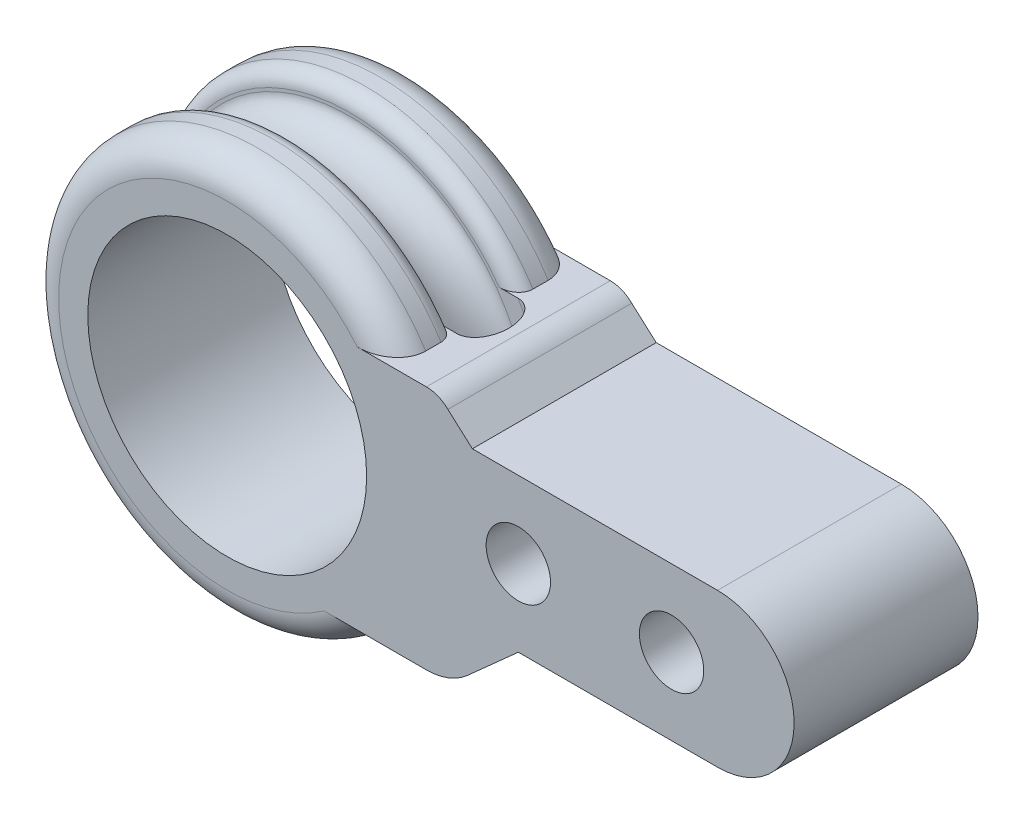
from build123d import *

# Parameters (mm, degrees)
BOSS_EXTRUDE1_DEPTH = 6
SKETCH1_5_R         = 4.55
CUT_EXTRUDE2_DEPTH  = 21.506096654
SKETCH1_6_R         = 1.05
CUT_EXTRUDE3_DEPTH  = 21.506096654
FILLET1_R           = 1
FILLET3_R           = 0.5


with BuildPart() as part:
    # Sketch1 → Boss-Extrude1 (new body)
    with BuildSketch(Plane.XY):
        with BuildLine():
            Line((9.5, -2.5), (16, -2.5))
            ThreePointArc((16, -2.5), (18.5, 0), (16, 2.5))
            Line((16, 2.5), (8, 2.5))
            Line((8, 2.5), (7.201136344, 3.213027227))
            ThreePointArc((7.201136344, 3.213027227), (6.878795969, 3.425480207), (6.5, 3.5))
            Line((6.5, 3.5), (5.477225575, 3.5))
            ThreePointArc((5.477225575, 3.5), (-6.468789112, 0.636213346), (4.69041576, -4.5))
            Line((4.69041576, -4.5), (6.5, -4.5))
            ThreePointArc((6.5, -4.5), (7.21364418, -4.368344718), (7.833333333, -3.990711985))
            Line((7.833333333, -3.990711985), (9.5, -2.5))
        make_face()
    extrude(amount=BOSS_EXTRUDE1_DEPTH)

    # Sketch1<5> → Cut-Extrude2 (cut, through all)
    with BuildSketch(Plane.XY):
        Circle(SKETCH1_5_R)
    extrude(amount=CUT_EXTRUDE2_DEPTH, mode=Mode.SUBTRACT)

    # Sketch1<6> → Cut-Extrude3 (cut, through all)
    with BuildSketch(Plane.XY):
        with Locations((14.5, 0)):
            Circle(SKETCH1_6_R)
        with Locations((9.5, 0)):
            Circle(SKETCH1_6_R)
    extrude(amount=CUT_EXTRUDE3_DEPTH, mode=Mode.SUBTRACT)

    # Sketch5 → Cut-Revolve2 (revolve, cut)
    with BuildSketch(Plane(origin=(0, 0, 0), x_dir=(0, 0, -1), z_dir=(1, 0, 0))):
        with BuildLine():
            Line((-3.998431193, 6.509033472), (-3.998431193, 5.899033472))
            add(Edge.make_bspline(
                [(-3.998431193, 5.899033472), (-3.998431193, 5.299033472), (-2.998431193, 5.299033472), (-1.998431193, 5.299033472), (-1.998431193, 5.899033472)],
                knots=[0, 0, 0, 1.570796327, 1.570796327, 3.141592654, 3.141592654, 3.141592654], degree=2, weights=[1, 0.707106781, 1, 0.707106781, 1]))
            Line((-1.998431193, 5.899033472), (-1.998431193, 6.509033472))
            add(Edge.make_bspline(
                [(-1.998431193, 6.509033472), (-1.998431193, 7.109033472), (-2.998431193, 7.109033472), (-3.998431193, 7.109033472), (-3.998431193, 6.509033472)],
                knots=[3.141592654, 3.141592654, 3.141592654, 4.71238898, 4.71238898, 6.283185307, 6.283185307, 6.283185307], degree=2, weights=[1, 0.707106781, 1, 0.707106781, 1]))
        make_face()
    revolve(axis=Axis((0, 0, 6.969963605), (0, 0, -1)), mode=Mode.SUBTRACT)

    # Fillet1
    fillet1_edges = [part.edges().sort_by_distance(p)[0] for p in [
        (-6.468789112, 0.636213346, 6),
        (-6.468789112, 0.636213346, 0),
    ]]
    fillet(fillet1_edges, radius=FILLET1_R)

    # Fillet3
    fillet3_edges = [part.edges().sort_by_distance(p)[0] for p in [
        (-6.468789112, 0.636213346, 1.998431193),
        (-6.468789112, 0.636213346, 3.998431193),
    ]]
    fillet(fillet3_edges, radius=FILLET3_R)


solid = part.part
